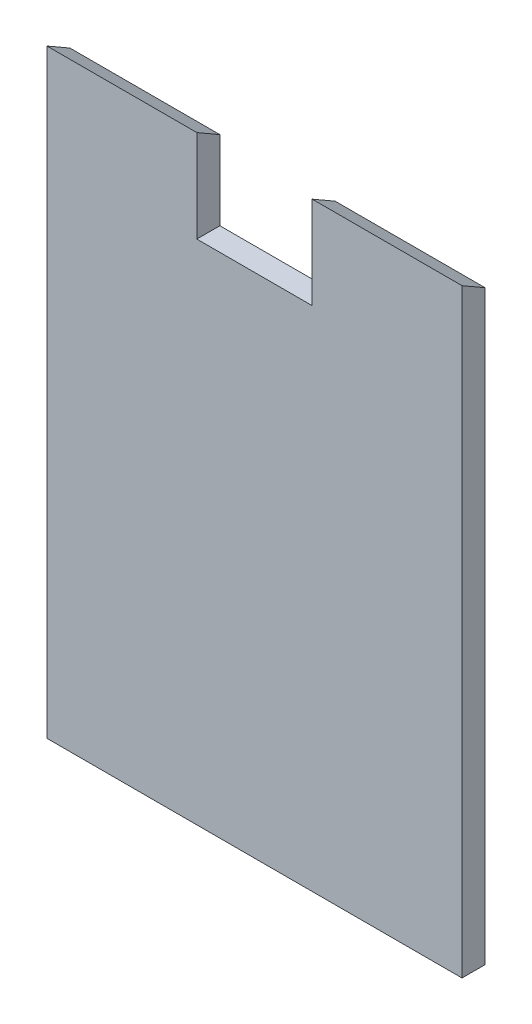
from build123d import *

# Parameters (mm, degrees)
BOSS_EXTRUDE1_DEPTH = 6.35
CUT_EXTRUDE1_DEPTH  = 127


with BuildPart() as part:
    # Sketch1 → Boss-Extrude1 (new, symmetric)
    with BuildSketch(Plane.XY):
        Polygon((114.3, -165.1), (-114.3, -165.1), (-114.3, 165.1), (-31.75, 165.1), (-31.75, 114.3), (31.75, 114.3), (31.75, 165.1), (114.3, 165.1), align=None)
    extrude(amount=BOSS_EXTRUDE1_DEPTH, both=True)

    # Sketch2 → Cut-Extrude1 (cut, symmetric)
    with BuildSketch(Plane(origin=(0, 0, 0), x_dir=(0, 0, -1), z_dir=(1, 0, 0))):
        Polygon((-6.35, 165.1), (6.35, 165.1), (6.35, 157.767651581), align=None)
    extrude(amount=CUT_EXTRUDE1_DEPTH, both=True, mode=Mode.SUBTRACT)


solid = part.part
